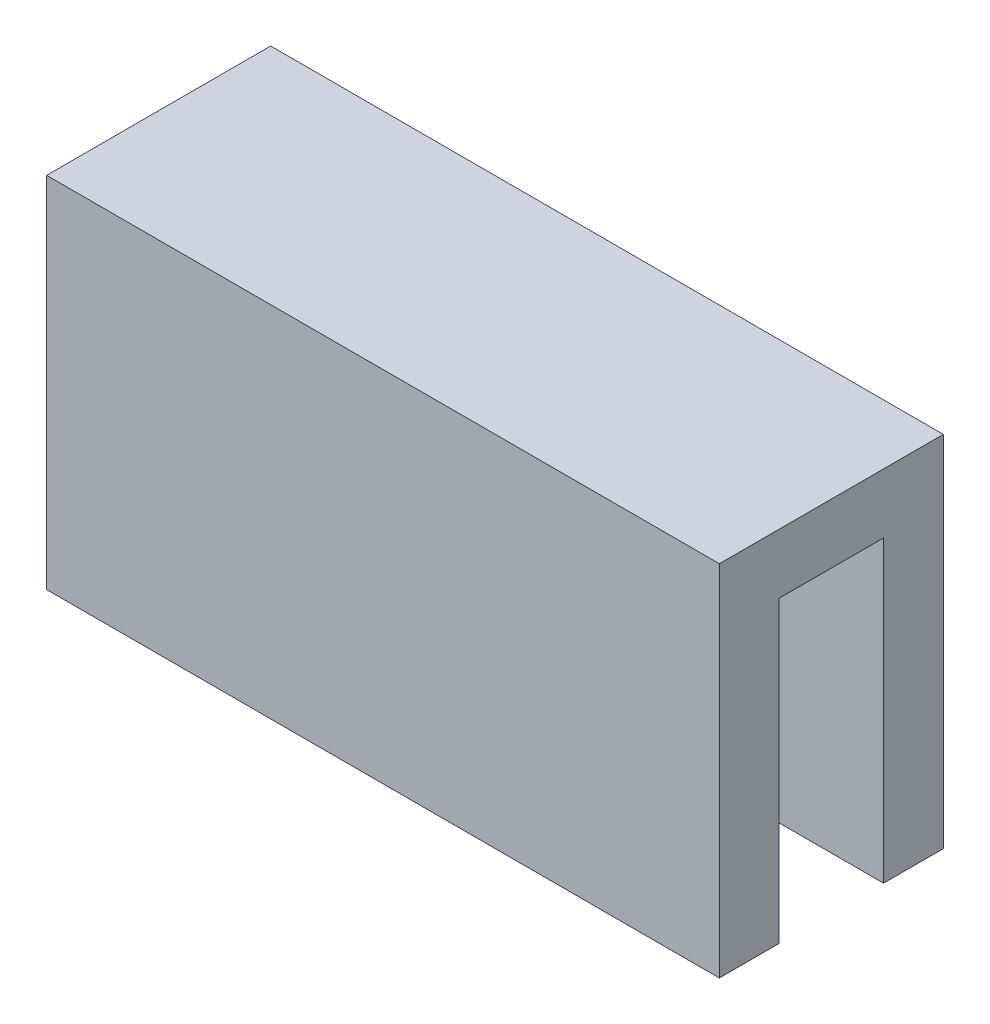
from build123d import *

# Parameters (mm, degrees)
SKETCH2_W           = 36
SKETCH2_H           = 19.2
BOSS_EXTRUDE1_DEPTH = 5.994
SKETCH3_W           = 36
SKETCH3_H           = 16
CUT_EXTRUDE1_DEPTH  = 2.794
SKETCH4_R           = 3.3
CUT_EXTRUDE2_DEPTH  = 2.6


with BuildPart() as part:
    # Sketch2 → Boss-Extrude1 (new, symmetric)
    with BuildSketch(Plane.XY):
        with Locations((0, -6.4)):
            Rectangle(SKETCH2_W, SKETCH2_H)
    extrude(amount=BOSS_EXTRUDE1_DEPTH, both=True)

    # Sketch3 → Cut-Extrude1 (cut, symmetric)
    with BuildSketch(Plane.XY):
        with Locations((0, -8)):
            Rectangle(SKETCH3_W, SKETCH3_H)
    extrude(amount=CUT_EXTRUDE1_DEPTH, both=True, mode=Mode.SUBTRACT)

    # Sketch4 → Cut-Extrude2 (cut)
    with BuildSketch(Plane.XY.offset(-5.994)):
        with Locations((11.7, -1.7)):
            Circle(SKETCH4_R)
        with Locations((3.9, -1.7)):
            Circle(SKETCH4_R)
        with Locations((-3.9, -1.7)):
            Circle(SKETCH4_R)
        with Locations((-11.7, -1.7)):
            Circle(SKETCH4_R)
    extrude(amount=CUT_EXTRUDE2_DEPTH, mode=Mode.SUBTRACT)


solid = part.part
